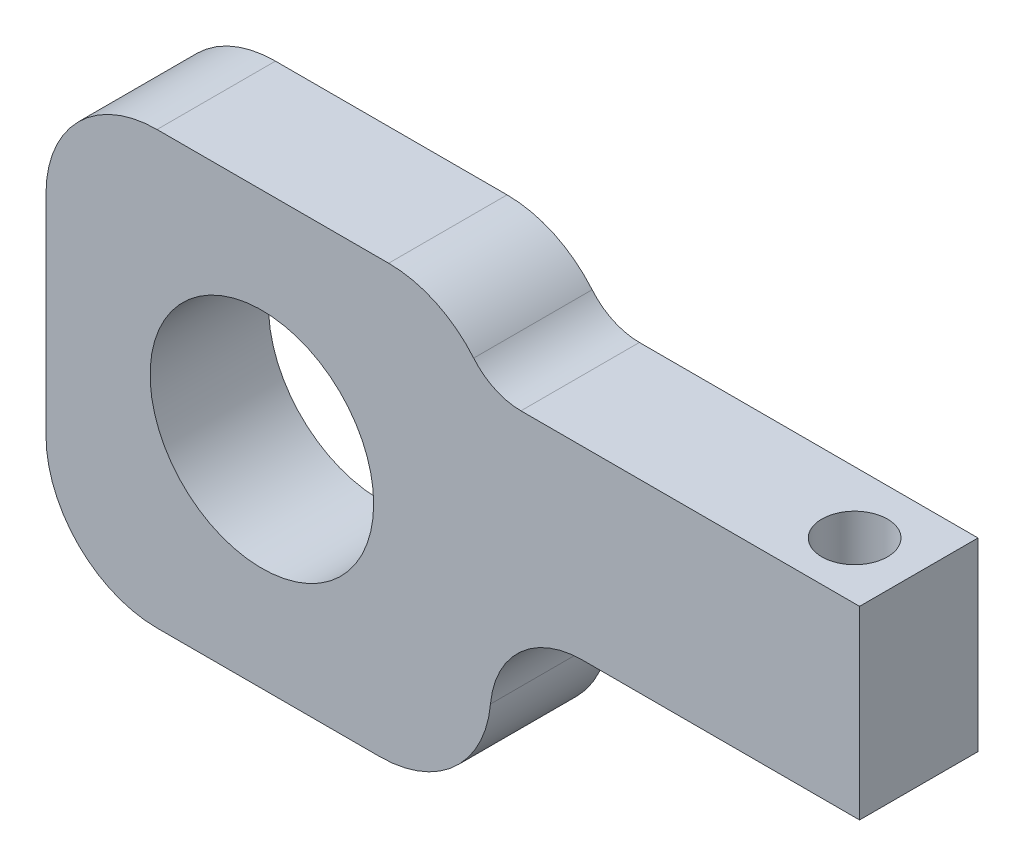
from build123d import *

# Parameters (mm, degrees)
SKETCH1_W           = 96.52
SKETCH1_H           = 44.45
BOSS_EXTRUDE1_DEPTH = 6.096
CUT_EXTRUDE1_REACH  = 108.961
SKETCH2_R           = 11.50874
CUT_EXTRUDE2_REACH  = 108.438
SKETCH3_R           = 3.3782
CUT_EXTRUDE3_REACH  = 108.961
SKETCH7_W           = 12.7635
SKETCH7_H           = 12.192
CUT_EXTRUDE5_DEPTH  = 104.946532487
FILLET1_R           = 11.43


with BuildPart() as part:
    # Sketch1 → Boss-Extrude1 (new, symmetric)
    with BuildSketch(Plane.XY):
        with Locations((48.26, -22.225)):
            Rectangle(SKETCH1_W, SKETCH1_H)
    extrude(amount=BOSS_EXTRUDE1_DEPTH, both=True)

    # Sketch2 → Cut-Extrude1 (cut, up to next)
    with BuildSketch(Plane.XY.offset(6.096), mode=Mode.PRIVATE) as cut_extrude1_sk1:
        with Locations((22.225, -22.225)):
            Circle(SKETCH2_R)
    cut_extrude1_tool1 = extrude(cut_extrude1_sk1.sketch, amount=-CUT_EXTRUDE1_REACH, mode=Mode.PRIVATE) & part.part
    add(cut_extrude1_tool1.solids().sort_by_distance((22.225, -22.225, 6.096))[0], mode=Mode.SUBTRACT)

    # Sketch3 → Cut-Extrude2 (cut, up to next)
    with BuildSketch(Plane(origin=(0, 0, 0), x_dir=(1, 0, 0), z_dir=(0, 1, 0)), mode=Mode.PRIVATE) as cut_extrude2_sk1:
        with Locations(Location((77.4065, -0.254, 0), (0, 0, 270))):
            Circle(SKETCH3_R)
    cut_extrude2_tool1 = extrude(cut_extrude2_sk1.sketch, amount=-CUT_EXTRUDE2_REACH, mode=Mode.PRIVATE) & part.part
    add(cut_extrude2_tool1.solids().sort_by_distance((77.4065, 0, 0.254))[0], mode=Mode.SUBTRACT)

    # Sketch4 → Cut-Extrude3 (cut, up to next)
    with BuildSketch(Plane.XY.offset(6.096), mode=Mode.PRIVATE) as cut_extrude3_sk1:
        with BuildLine():
            Line((48.895, 6.35), (96.52, 6.35))
            ThreePointArc((96.52, 6.35), (102.87, 0), (96.52, -6.35))
            Line((96.52, -6.35), (48.895, -6.35))
            ThreePointArc((48.895, -6.35), (42.545, 0), (48.895, 6.35))
        make_face()
    cut_extrude3_tool1 = extrude(cut_extrude3_sk1.sketch, amount=-CUT_EXTRUDE3_REACH, mode=Mode.PRIVATE) & part.part
    # Sketch4 → Cut-Extrude3 (cut, up to next)
    with BuildSketch(Plane.XY.offset(6.096), mode=Mode.PRIVATE) as cut_extrude3_sk2:
        with BuildLine():
            Line((45.72, -34.925), (45.72, -44.45))
            Line((45.72, -44.45), (55.245, -44.45))
            Line((55.245, -44.45), (96.52, -44.45))
            ThreePointArc((96.52, -44.45), (106.045, -34.925), (96.52, -25.4))
            Line((96.52, -25.4), (55.245, -25.4))
            ThreePointArc((55.245, -25.4), (48.509807909, -28.189807909), (45.72, -34.925))
        make_face()
    cut_extrude3_tool2 = extrude(cut_extrude3_sk2.sketch, amount=-CUT_EXTRUDE3_REACH, mode=Mode.PRIVATE) & part.part
    add(cut_extrude3_tool1.solids().sort_by_distance((72.7075, 0, 6.096))[0], mode=Mode.SUBTRACT)
    add(cut_extrude3_tool2.solids().sort_by_distance((75.382091, -35.05704, 6.096))[0], mode=Mode.SUBTRACT)

    # Sketch7 → Cut-Extrude5 (cut, through all)
    with BuildSketch(Plane(origin=(0, -6.35, 0), x_dir=(1, 0, 0), z_dir=(0, 1, 0))):
        with Locations((90.13825, 0)):
            Rectangle(SKETCH7_W, SKETCH7_H)
    extrude(amount=-CUT_EXTRUDE5_DEPTH, mode=Mode.SUBTRACT)

    # Fillet1
    fillet1_edges = [part.edges().sort_by_distance(p)[0] for p in [
        (42.545, 0, 0),
        (45.72, -44.45, 0),
        (0, -44.45, 0),
        (0, 0, 0),
    ]]
    fillet(fillet1_edges, radius=FILLET1_R)


solid = part.part
